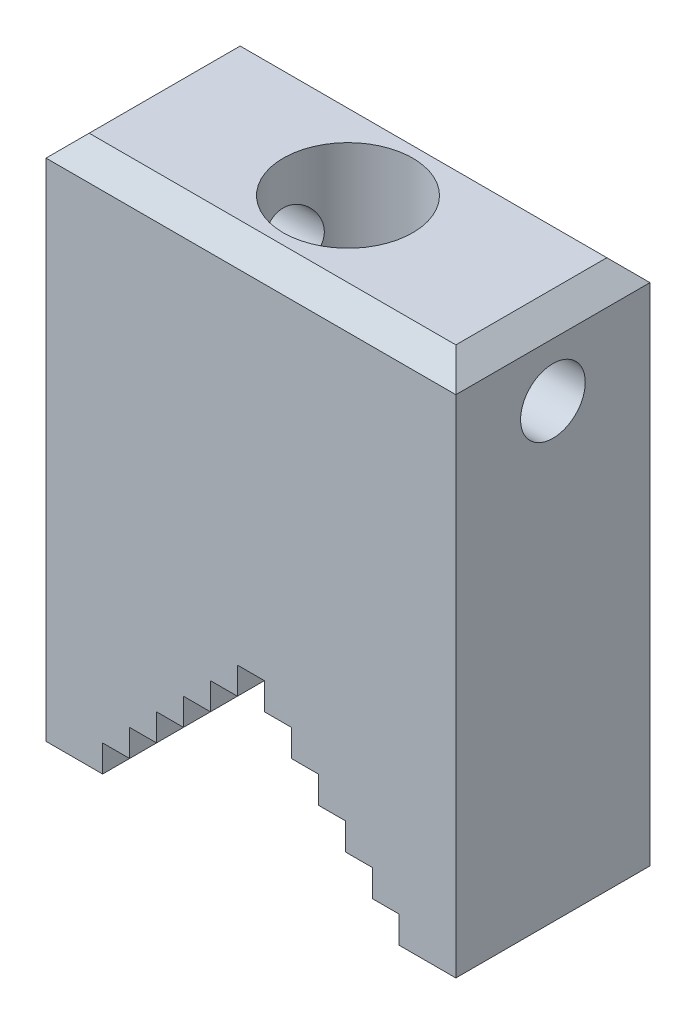
from build123d import *

# Parameters (mm, degrees)
BOSS_EXTRUDE1_DEPTH       = 18
CHAMFER1_SIZE             = 2
CUT_EXTRUDE1_DEPTH        = 49.624263051
CUT_EXTRUDE1_DEPTH_BACK   = 49.624263051
SKETCH3_R                 = 3
F_1_0MM_DOWEL_HOLE1_D     = 12
F_1_0MM_DOWEL_HOLE1_DEPTH = 20
F_1_0MM_DOWEL_HOLE1_TIP   = 3.464101615


with BuildPart() as part:
    # Sketch1 → Boss-Extrude1 (new body)
    with BuildSketch(Plane.XY):
        Polygon((-13.75, -24.419642857), (-13.75, -21.919642857), (-11.25, -21.919642857), (-11.25, -19.419642857), (-8.75, -19.419642857), (-8.75, -16.919642857), (-6.25, -16.919642857), (-6.25, -14.419642857), (-3.75, -14.419642857), (-3.75, -11.919642857), (-1.25, -11.919642857), (-1.25, -9.419642857), (1.25, -9.419642857), (1.25, -11.919642857), (3.75, -11.919642857), (3.75, -14.419642857), (6.25, -14.419642857), (6.25, -16.919642857), (8.75, -16.919642857), (8.75, -19.419642857), (11.25, -19.419642857), (11.25, -21.919642857), (13.75, -21.919642857), (13.75, -24.419642857), (19, -24.419642857), (19, 24.419642857), (-19, 24.419642857), (-19, -24.419642857), align=None)
    extrude(amount=BOSS_EXTRUDE1_DEPTH)

    # Chamfer1
    chamfer1_edges = [part.edges().sort_by_distance(p)[0] for p in [
        (0, 24.419642857, 0),
        (-19, 24.419642857, 9),
        (19, 24.419642857, 9),
        (0, 24.419642857, 18),
    ]]
    chamfer(chamfer1_edges, length=CHAMFER1_SIZE)

    # Sketch3 → Cut-Extrude1 (cut, two sides: drawn at the far end of the back side and taken through both)
    with BuildSketch(Plane(origin=(19, 0, 0), x_dir=(0, 0, -1), z_dir=(1, 0, 0)).offset(-CUT_EXTRUDE1_DEPTH_BACK)):
        with Locations((-9, 17.419642857)):
            Circle(SKETCH3_R)
    extrude(amount=CUT_EXTRUDE1_DEPTH + CUT_EXTRUDE1_DEPTH_BACK, mode=Mode.SUBTRACT)

    # Ø1.0mm Dowel Hole1
    with Locations(Plane(origin=(0, 24.419642857, 0), x_dir=(1, 0, 0), z_dir=(0, 1, 0))):
        with Locations((0, -9)):
            Hole(F_1_0MM_DOWEL_HOLE1_D / 2, depth=F_1_0MM_DOWEL_HOLE1_DEPTH)
            with Locations((0, 0, -(F_1_0MM_DOWEL_HOLE1_DEPTH + F_1_0MM_DOWEL_HOLE1_TIP / 2))):  # 120° drill point
                Cone(0, F_1_0MM_DOWEL_HOLE1_D / 2, F_1_0MM_DOWEL_HOLE1_TIP, mode=Mode.SUBTRACT)


solid = part.part
